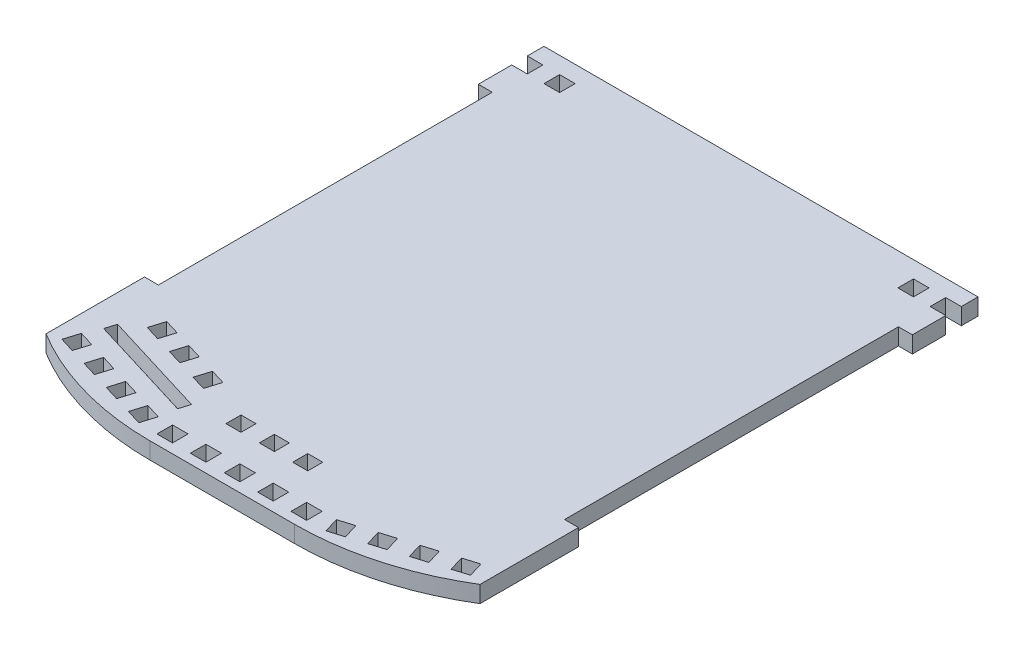
from build123d import *

# Parameters (mm, degrees)
SKETCH1_W           = 2.8
SKETCH1_H           = 2.8
SKETCH1_W_2         = 2.7
SKETCH1_H_2         = 2.7
BOSS_EXTRUDE1_DEPTH = 3


with BuildPart() as part:
    # Sketch1 → Boss-Extrude1 (new body)
    with BuildSketch(Plane(origin=(0, 0, 0), x_dir=(1, 0, 0), z_dir=(0, 1, 0))):
        with BuildLine():
            Line((-37.844649751, 18.090932989), (-37.844649751, 15.090932989))
            Line((-37.844649751, 15.090932989), (-35.044649751, 15.090932989))
            Line((-35.044649751, 15.090932989), (-35.044649751, 12.290932989))
            Line((-35.044649751, 12.290932989), (-37.844649751, 12.290932989))
            Line((-37.844649751, 12.290932989), (-37.844649751, 6.290932989))
            Line((-37.844649751, 6.290932989), (-35.344649751, 6.290932989))
            Line((-35.344649751, 6.290932989), (-35.344649751, -53.709067011))
            Line((-35.344649751, -53.709067011), (-37.844649751, -53.709067011))
            Line((-37.844649751, -53.709067011), (-37.844649751, -71.409067011))
            ThreePointArc((-37.844649751, -71.409067011), (-25.332467624, -76.857542339), (-11.813147026, -78.719948188))
            Line((-11.813147026, -78.719948188), (-8.844649751, -78.719948188))
            Line((-8.844649751, -78.719948188), (1.155350249, -78.719948188))
            Line((1.155350249, -78.719948188), (11.155350249, -78.719948188))
            Line((11.155350249, -78.719948188), (14.123847524, -78.719948188))
            ThreePointArc((14.123847524, -78.719948188), (27.643168122, -76.857542339), (40.155350249, -71.409067011))
            Line((40.155350249, -71.409067011), (40.155350249, -53.709067011))
            Line((40.155350249, -53.709067011), (37.655350249, -53.709067011))
            Line((37.655350249, -53.709067011), (37.655350249, 6.290932989))
            Line((37.655350249, 6.290932989), (40.155350249, 6.290932989))
            Line((40.155350249, 6.290932989), (40.155350249, 12.290932989))
            Line((40.155350249, 12.290932989), (37.355350249, 12.290932989))
            Line((37.355350249, 12.290932989), (37.355350249, 15.090932989))
            Line((37.355350249, 15.090932989), (40.155350249, 15.090932989))
            Line((40.155350249, 15.090932989), (40.155350249, 18.090932989))
            Line((40.155350249, 18.090932989), (-37.844649751, 18.090932989))
        make_face()
        Polygon((-35.567709863, -70.827218463), (-34.74906909, -68.149565146), (-32.071415773, -68.96820592), (-32.890056546, -71.645859236), align=None, mode=Mode.SUBTRACT)
        Polygon((-29.829881327, -72.581448691), (-29.011240554, -69.903795375), (-26.333587237, -70.722436148), (-27.15222801, -73.400089465), align=None, mode=Mode.SUBTRACT)
        Polygon((-14.857930166, -74.230896605), (-15.676570939, -76.908549921), (-18.354224255, -76.089909148), (-17.535583482, -73.412255831), align=None, mode=Mode.SUBTRACT)
        Polygon((-23.273412018, -71.658025603), (-20.595758701, -72.476666376), (-21.414399475, -75.154319693), (-24.092052791, -74.33567892), align=None, mode=Mode.SUBTRACT)
        Polygon((-33.489432073, -65.39759956), (-32.904688664, -63.484990048), (-13.778593544, -69.332424143), (-14.363336954, -71.245033655), align=None, mode=Mode.SUBTRACT)
        with Locations((-10.894649751, -75.619948559)):
            Rectangle(SKETCH1_W, SKETCH1_H, mode=Mode.SUBTRACT)
        with Locations((-4.894649751, -75.619948559)):
            Rectangle(SKETCH1_W, SKETCH1_H, mode=Mode.SUBTRACT)
        with Locations((-6.344649714, -67.869948559)):
            Rectangle(SKETCH1_W_2, SKETCH1_H_2, mode=Mode.SUBTRACT)
        Polygon((-29.732442135, -61.317767872), (-28.913801362, -58.640114555), (-26.236148045, -59.458755328), (-27.054788818, -62.136408645), align=None, mode=Mode.SUBTRACT)
        Polygon((-23.994613599, -63.0719981), (-23.175972826, -60.394344784), (-20.498319509, -61.212985557), (-21.316960283, -63.890638873), align=None, mode=Mode.SUBTRACT)
        Polygon((-17.055622388, -62.265523694), (-14.377969071, -63.084164467), (-15.196609844, -65.761817784), (-17.874263161, -64.94317701), align=None, mode=Mode.SUBTRACT)
        with Locations((1.205350249, -75.619949313)):
            Rectangle(SKETCH1_W, SKETCH1_H, mode=Mode.SUBTRACT)
        with Locations((-0.344649714, -67.869948559)):
            Rectangle(SKETCH1_W_2, SKETCH1_H_2, mode=Mode.SUBTRACT)
        with Locations((5.655350286, -67.869948559)):
            Rectangle(SKETCH1_W_2, SKETCH1_H_2, mode=Mode.SUBTRACT)
        with Locations((7.205350249, -75.619948559)):
            Rectangle(SKETCH1_W, SKETCH1_H, mode=Mode.SUBTRACT)
        with Locations((13.205350249, -75.619948559)):
            Rectangle(SKETCH1_W, SKETCH1_H, mode=Mode.SUBTRACT)
        Polygon((17.987271436, -76.908549921), (17.168630663, -74.230896605), (19.84628398, -73.412255831), (20.664924753, -76.089909148), align=None, mode=Mode.SUBTRACT)
        Polygon((23.725099972, -75.154319693), (22.906459199, -72.476666376), (25.584112516, -71.658025603), (26.402753289, -74.33567892), align=None, mode=Mode.SUBTRACT)
        Polygon((28.644287735, -70.722436148), (31.321941051, -69.903795375), (32.140581825, -72.581448691), (29.462928508, -73.400089465), align=None, mode=Mode.SUBTRACT)
        Polygon((34.38211627, -68.96820592), (37.059769587, -68.149565146), (37.87841036, -70.827218463), (35.200757044, -71.645859236), align=None, mode=Mode.SUBTRACT)
        with Locations((-30.644649751, 13.690932989)):
            Rectangle(SKETCH1_W, SKETCH1_H, mode=Mode.SUBTRACT)
        with Locations((32.955350249, 13.690932989)):
            Rectangle(SKETCH1_W, SKETCH1_H, mode=Mode.SUBTRACT)
    extrude(amount=BOSS_EXTRUDE1_DEPTH)


solid = part.part
